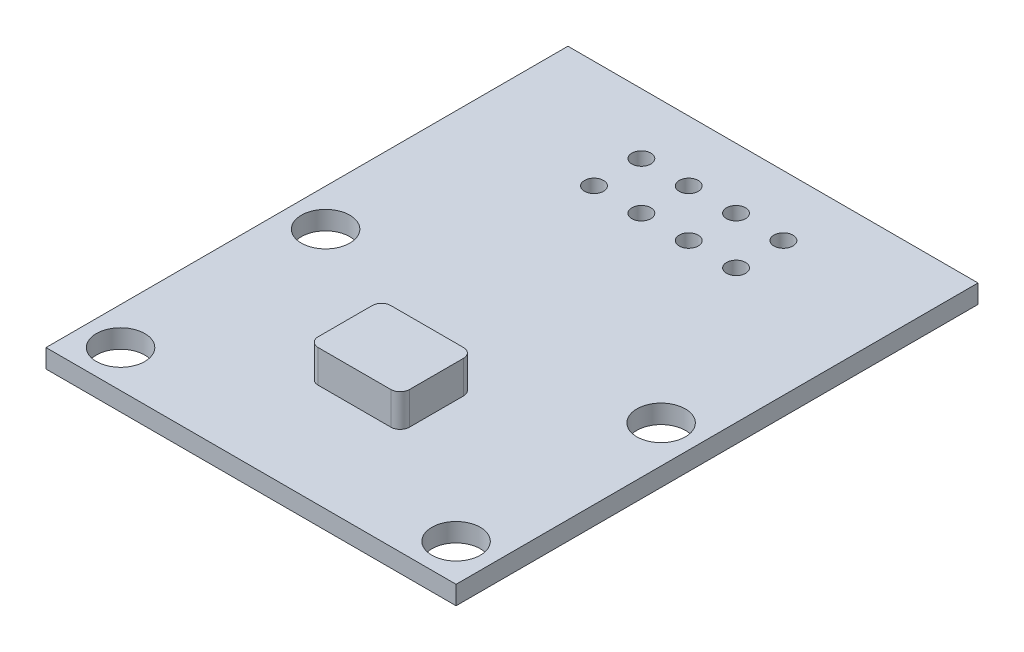
from build123d import *

# Parameters (mm, degrees)
SKETCH1_W           = 22
SKETCH1_H           = 28
SKETCH1_R           = 1.3
SKETCH1_R_2         = 0.51
BOSS_EXTRUDE1_DEPTH = 1
BOSS_EXTRUDE2_DEPTH = 1.75


with BuildPart() as part:
    # Sketch1 → Boss-Extrude1 (new body)
    with BuildSketch(Plane(origin=(0, 0, 0), x_dir=(1, 0, 0), z_dir=(0, 1, 0))):
        with Locations((11, 14)):
            Rectangle(SKETCH1_W, SKETCH1_H)
        with Locations(Location((2, 2, 0), (0, 0, 270))):
            Circle(SKETCH1_R, mode=Mode.SUBTRACT)
        with Locations(Location((20, 2, 0), (0, 0, 270))):
            Circle(SKETCH1_R, mode=Mode.SUBTRACT)
        with Locations(Location((20, 13, 0), (0, 0, 270))):
            Circle(SKETCH1_R, mode=Mode.SUBTRACT)
        with Locations(Location((2, 13, 0), (0, 0, 270))):
            Circle(SKETCH1_R, mode=Mode.SUBTRACT)
        with Locations(Location((14.81, 24.75, 0), (0, 0, 270))):
            Circle(SKETCH1_R_2, mode=Mode.SUBTRACT)
        with Locations(Location((14.81, 22.21, 0), (0, 0, 270))):
            Circle(SKETCH1_R_2, mode=Mode.SUBTRACT)
        with Locations(Location((12.27, 24.75, 0), (0, 0, 270))):
            Circle(SKETCH1_R_2, mode=Mode.SUBTRACT)
        with Locations(Location((9.73, 24.75, 0), (0, 0, 270))):
            Circle(SKETCH1_R_2, mode=Mode.SUBTRACT)
        with Locations(Location((7.19, 24.75, 0), (0, 0, 270))):
            Circle(SKETCH1_R_2, mode=Mode.SUBTRACT)
        with Locations(Location((12.27, 22.21, 0), (0, 0, 270))):
            Circle(SKETCH1_R_2, mode=Mode.SUBTRACT)
        with Locations(Location((9.73, 22.21, 0), (0, 0, 270))):
            Circle(SKETCH1_R_2, mode=Mode.SUBTRACT)
        with Locations(Location((7.19, 22.21, 0), (0, 0, 270))):
            Circle(SKETCH1_R_2, mode=Mode.SUBTRACT)
    extrude(amount=BOSS_EXTRUDE1_DEPTH)

    # Sketch2 → Boss-Extrude2 (add)
    with BuildSketch(Plane(origin=(0, 1, 0), x_dir=(1, 0, 0), z_dir=(0, 1, 0))):
        with BuildLine():
            Line((9.05, 9.45), (12.95, 9.45))
            ThreePointArc((12.95, 9.45), (13.303553391, 9.303553391), (13.45, 8.95))
            Line((13.45, 8.95), (13.45, 6.05))
            ThreePointArc((13.45, 6.05), (13.303553391, 5.696446609), (12.95, 5.55))
            Line((12.95, 5.55), (9.05, 5.55))
            ThreePointArc((9.05, 5.55), (8.696446609, 5.696446609), (8.55, 6.05))
            Line((8.55, 6.05), (8.55, 8.95))
            ThreePointArc((8.55, 8.95), (8.696446609, 9.303553391), (9.05, 9.45))
        make_face()
    extrude(amount=BOSS_EXTRUDE2_DEPTH)


solid = part.part
